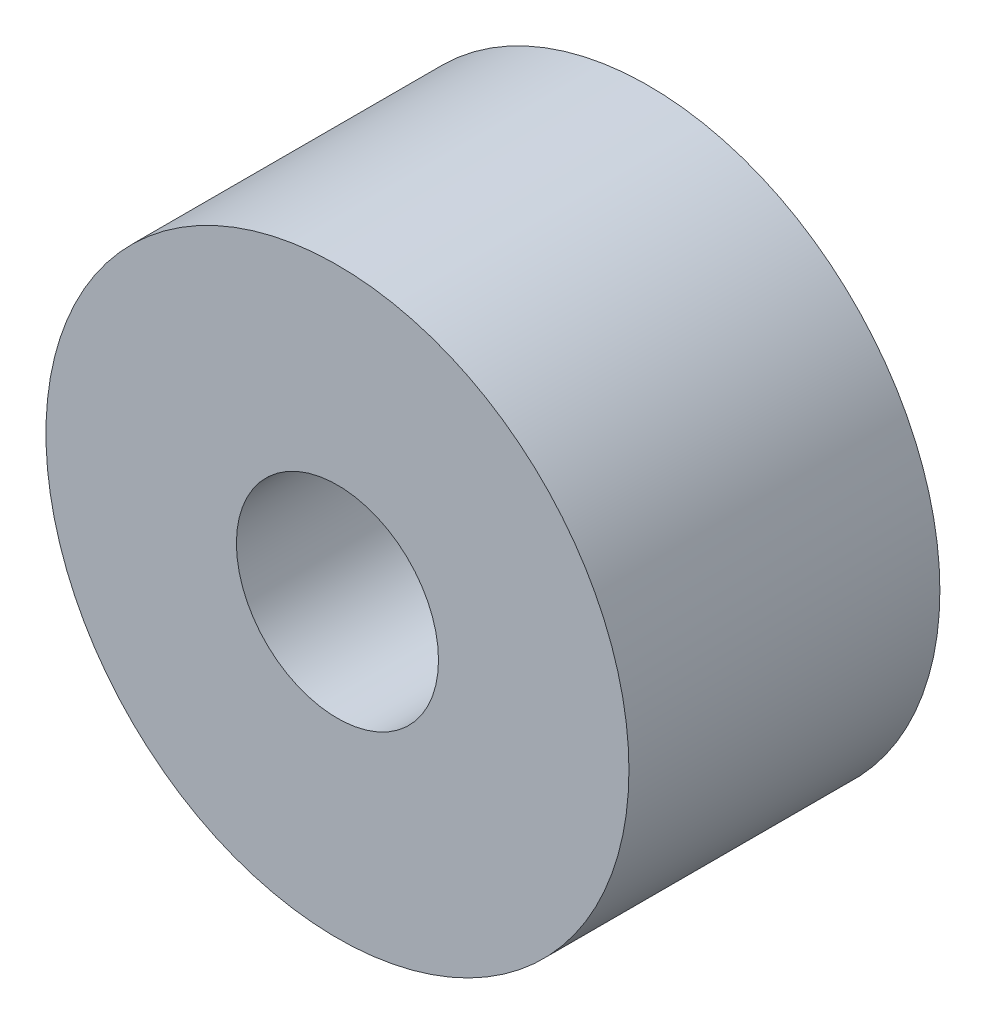
from build123d import *

# Parameters (mm, degrees)
SKETCH_1_R      = 7.5
SKETCH_1_R_2    = 2.6
EXTRUDE_1_DEPTH = 8


with BuildPart() as part:
    # 草图1 → 凸台-拉伸1 (new body)
    with BuildSketch(Plane.XY):
        Circle(SKETCH_1_R)
        Circle(SKETCH_1_R_2, mode=Mode.SUBTRACT)
    extrude(amount=EXTRUDE_1_DEPTH)


solid = part.part
